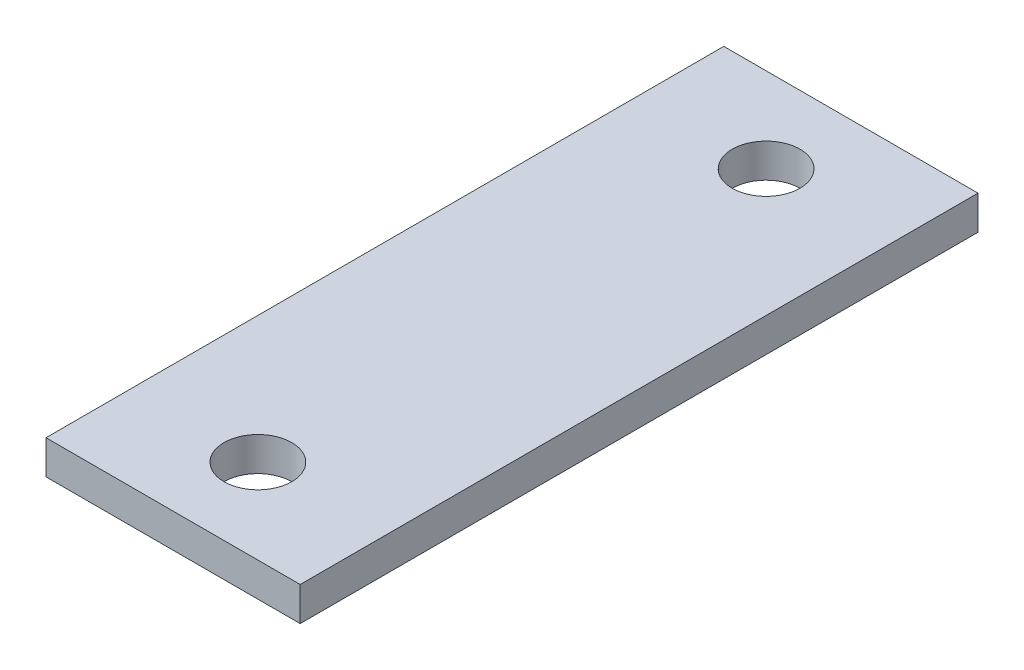
from build123d import *

# Parameters (mm, degrees)
SKETCH2_W           = 15
SKETCH2_H           = 40
BOSS_EXTRUDE1_DEPTH = 2
SKETCH3_R           = 1.5
CUT_EXTRUDE1_DEPTH  = 0.5
SKETCH4_R           = 2
CUT_EXTRUDE2_DEPTH  = 10


with BuildPart() as part:
    # Sketch2 → Boss-Extrude1 (new body)
    with BuildSketch(Plane(origin=(0, 0, 0), x_dir=(1, 0, 0), z_dir=(0, 1, 0))):
        Rectangle(SKETCH2_W, SKETCH2_H)
    extrude(amount=BOSS_EXTRUDE1_DEPTH)

    # Sketch3 → Cut-Extrude1 (cut)
    with BuildSketch(Plane(origin=(0, 0, 0), x_dir=(-1, 0, 0), z_dir=(0, -1, 0))):
        with Locations(Location((0, 0, 0), (0, 0, 90))):
            Circle(SKETCH3_R)
    extrude(amount=-CUT_EXTRUDE1_DEPTH, mode=Mode.SUBTRACT)

    # Sketch4 → Cut-Extrude2 (cut)
    with BuildSketch(Plane(origin=(0, 2, 0), x_dir=(1, 0, 0), z_dir=(0, 1, 0))):
        with Locations(Location((0, 14.995463788, 0), (0, 0, 270))):
            Circle(SKETCH4_R)
        with Locations(Location((0, -14.995463788, 0), (0, 0, 270))):
            Circle(SKETCH4_R)
    extrude(amount=-CUT_EXTRUDE2_DEPTH, mode=Mode.SUBTRACT)


solid = part.part
